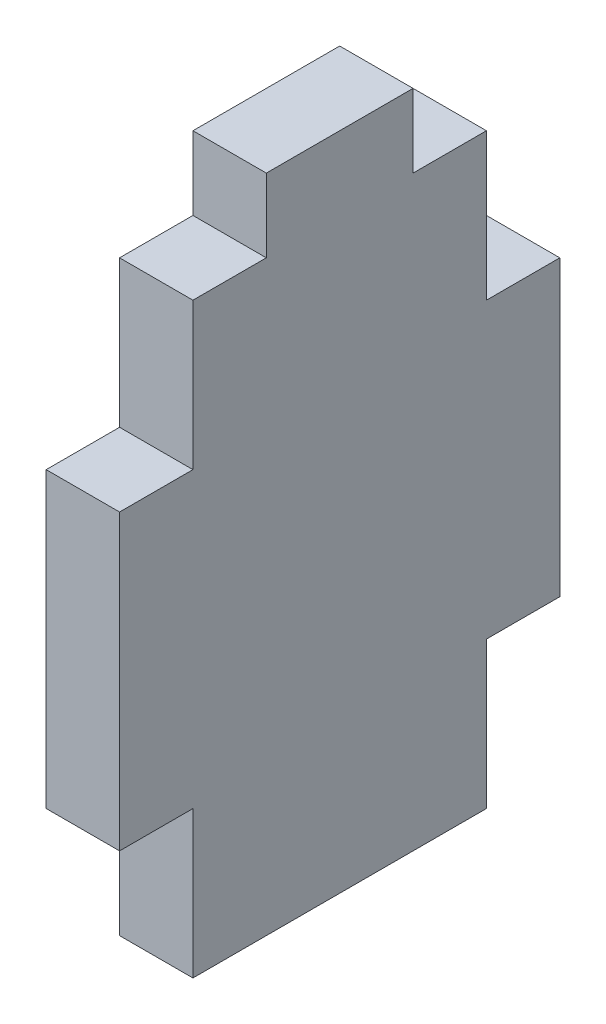
from build123d import *

# Parameters (mm, degrees)
EXTRUDE_1_DEPTH = 5


with BuildPart() as part:
    # 草图2 → 凸台-拉伸1 (new body)
    with BuildSketch(Plane(origin=(0, 0, 0), x_dir=(0, 0, -1), z_dir=(1, 0, 0))):
        Polygon((-15, 40), (-20, 40), (-20, 30), (-25, 30), (-25, 10), (-20, 10), (-20, 0), (0, 0), (0, 10), (5, 10), (5, 30), (0, 30), (0, 40), (-5, 40), (-5, 45), (-15, 45), align=None)
    extrude(amount=EXTRUDE_1_DEPTH)


solid = part.part
